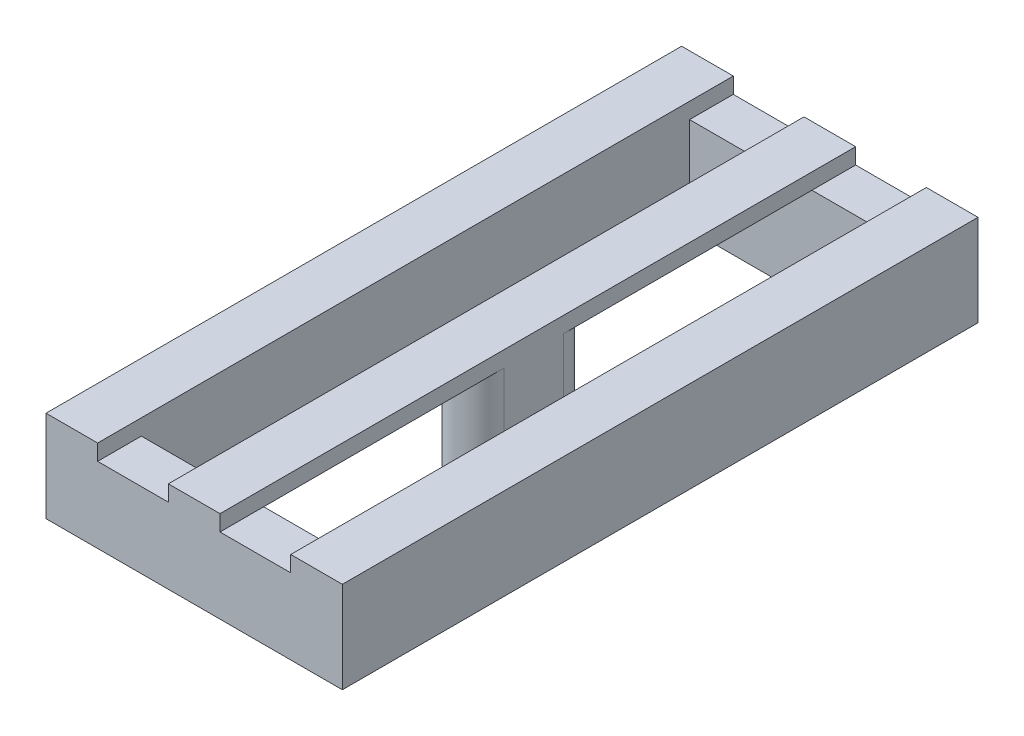
from build123d import *

# Parameters (mm, degrees)
BOSS_EXTRUDE1_DEPTH = 16
SKETCH2_W           = 1.78
SKETCH2_H           = 13.8
CUT_EXTRUDE3_DEPTH  = 17.538527746
SKETCH3_W           = 1.3
SKETCH3_H           = 13.8
CUT_EXTRUDE4_DEPTH  = 2.8
BOSS_EXTRUDE2_DEPTH = 3.4
SKETCH5_W           = 6.46
SKETCH5_H           = 15
BOSS_EXTRUDE3_DEPTH = 0.5
SKETCH7_W           = 1.78
SKETCH7_H           = 13.8
CUT_EXTRUDE5_DEPTH  = 17.718938363
SKETCH8_W           = 1.3
SKETCH8_H           = 13.8
CUT_EXTRUDE6_DEPTH  = 0.1
CUT_EXTRUDE7_START  = -1
CUT_EXTRUDE7_DEPTH  = 1
FILLET1_R           = 0.3
SKETCH10_W          = 7.46
SKETCH10_H          = 0.8
CUT_EXTRUDE9_DEPTH  = 17.718938363
SKETCH11_W          = 1.3
SKETCH11_H          = 0.4
BOSS_EXTRUDE4_DEPTH = 13.8


with BuildPart() as part:
    # Sketch1 → Boss-Extrude1 (new body)
    with BuildSketch(Plane.XY):
        Polygon((-3.73, 0), (3.73, 0), (3.73, 3.1), (2.43, 3.1), (2.43, 1.9), (0.65, 1.9), (0.65, 3.1), (-0.65, 3.1), (-0.65, 1.9), (-2.43, 1.9), (-2.43, 3.1), (-3.73, 3.1), align=None)
    extrude(amount=-BOSS_EXTRUDE1_DEPTH)

    # Sketch2 → Cut-Extrude3 (cut, through all)
    with BuildSketch(Plane(origin=(0, 1.9, 0), x_dir=(1, 0, 0), z_dir=(0, 1, 0))):
        with Locations((1.54, 8)):
            Rectangle(SKETCH2_W, SKETCH2_H)
    cut_extrude3 = extrude(amount=-CUT_EXTRUDE3_DEPTH, mode=Mode.SUBTRACT)

    # Mirror1: Cut-Extrude3 across plane
    add(cut_extrude3.mirror(Plane(origin=(0, 0, 0), x_dir=(0, 0, 1), z_dir=(1, 0, 0))), mode=Mode.SUBTRACT)

    # Sketch3 → Cut-Extrude4 (cut)
    with BuildSketch(Plane.XZ):
        with Locations((0, -8)):
            Rectangle(SKETCH3_W, SKETCH3_H)
    extrude(amount=-CUT_EXTRUDE4_DEPTH, mode=Mode.SUBTRACT)

    # Sketch4 → Boss-Extrude2 (add)
    with BuildSketch(Plane.XZ.offset(-2.8)):
        with BuildLine():
            Line((0.65, -7.15), (0.65, -8.65))
            ThreePointArc((0.65, -8.65), (0, -9.3), (-0.65, -8.65))
            Line((-0.65, -8.65), (-0.65, -7.15))
            ThreePointArc((-0.65, -7.15), (0, -6.5), (0.65, -7.15))
        make_face()
    extrude(amount=BOSS_EXTRUDE2_DEPTH)

    # Sketch5 → Boss-Extrude3 (add)
    with BuildSketch(Plane.XZ):
        with Locations((0, -8)):
            Rectangle(SKETCH5_W, SKETCH5_H)
    extrude(amount=BOSS_EXTRUDE3_DEPTH)

    # Sketch7 → Cut-Extrude5 (cut, through all)
    with BuildSketch(Plane(origin=(0, 0, 0), x_dir=(1, 0, 0), z_dir=(0, 1, 0))):
        with Locations((-1.54, 8)):
            Rectangle(SKETCH7_W, SKETCH7_H)
    cut_extrude5 = extrude(amount=-CUT_EXTRUDE5_DEPTH, mode=Mode.SUBTRACT)

    # Mirror2: Cut-Extrude5 across plane
    add(cut_extrude5.mirror(Plane(origin=(0, 0, 0), x_dir=(0, 0, 1), z_dir=(1, 0, 0))), mode=Mode.SUBTRACT)

    # Sketch8 → Cut-Extrude6 (cut)
    with BuildSketch(Plane.XZ.offset(0.5)):
        with Locations((0, -8)):
            Rectangle(SKETCH8_W, SKETCH8_H)
    extrude(amount=CUT_EXTRUDE6_DEPTH, mode=Mode.SUBTRACT)

    # Sketch9 → Cut-Extrude7 (cut)
    with BuildSketch(Plane.XZ.offset(0.5).offset(CUT_EXTRUDE7_START)):
        with BuildLine():
            Line((-0.65, -14.9), (0.65, -14.9))
            Line((0.65, -14.9), (0.65, -8.65))
            ThreePointArc((0.65, -8.65), (0, -9.3), (-0.65, -8.65))
            Line((-0.65, -8.65), (-0.65, -14.9))
        make_face()
    cut_extrude7 = extrude(amount=CUT_EXTRUDE7_DEPTH, mode=Mode.SUBTRACT)

    # Mirror3: Cut-Extrude7 across plane
    add(cut_extrude7.mirror(Plane.XY.offset(-7.9)), mode=Mode.SUBTRACT)

    # Fillet1
    fillet1_edges = [part.edges().sort_by_distance(p)[0] for p in [
        (3.23, -0.25, -0.5),
        (-3.23, -0.25, -0.5),
        (-3.23, -0.25, -15.5),
        (3.23, -0.25, -15.5),
    ]]
    fillet(fillet1_edges, radius=FILLET1_R)

    # Sketch10 → Cut-Extrude9 (cut, through all)
    with BuildSketch(Plane.XY):
        with Locations((0, 2.7)):
            Rectangle(SKETCH10_W, SKETCH10_H)
    extrude(amount=-CUT_EXTRUDE9_DEPTH, mode=Mode.SUBTRACT)


with BuildPart() as cut_extrude9_piece_1:
    # of the separate pieces the step leaves, piece 1, a body of its own (cut_extrude9_pieces)
    add(part.part.solids().sort_by_distance((-2.93, 0, -0.5))[0])



with BuildPart() as cut_extrude9_piece_2:
    # of the separate pieces the step leaves, piece 2, a body of its own (cut_extrude9_pieces)
    add(part.part.solids().sort_by_distance((-0.65, -0.5, -7.15))[0])


with BuildPart() as cut_extrude9_piece_1_1:
    add(cut_extrude9_piece_1.part)

    add(cut_extrude9_piece_2.part)  # Boss-Extrude4 merges Cut-Extrude9 piece 2
    # Sketch11 → Boss-Extrude4 (add)
    with BuildSketch(Plane(origin=(0, 0, -1.1), x_dir=(-1, 0, 0), z_dir=(0, 0, -1))):
        with Locations((0, 2.1)):
            Rectangle(SKETCH11_W, SKETCH11_H)
    extrude(amount=BOSS_EXTRUDE4_DEPTH)


solid = cut_extrude9_piece_1_1.part
